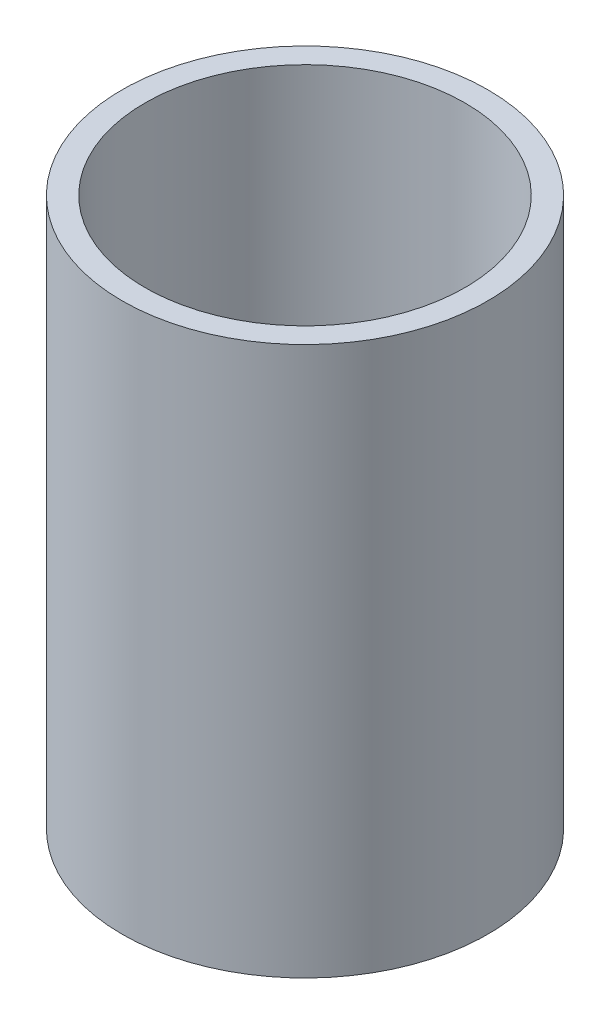
from build123d import *

# Parameters (mm, degrees)
SKETCH1_R           = 12.7
SKETCH1_R_2         = 11.1125
BOSS_EXTRUDE1_DEPTH = 38.1


with BuildPart() as part:
    # Sketch1 → Boss-Extrude1 (new body)
    with BuildSketch(Plane(origin=(0, 0, 0), x_dir=(1, 0, 0), z_dir=(0, 1, 0))):
        with Locations(Location((0, 0, 0), (0, 0, 90))):
            Circle(SKETCH1_R)
        with Locations(Location((0, 0, 0), (0, 0, 90))):
            Circle(SKETCH1_R_2, mode=Mode.SUBTRACT)
    extrude(amount=BOSS_EXTRUDE1_DEPTH)


solid = part.part
